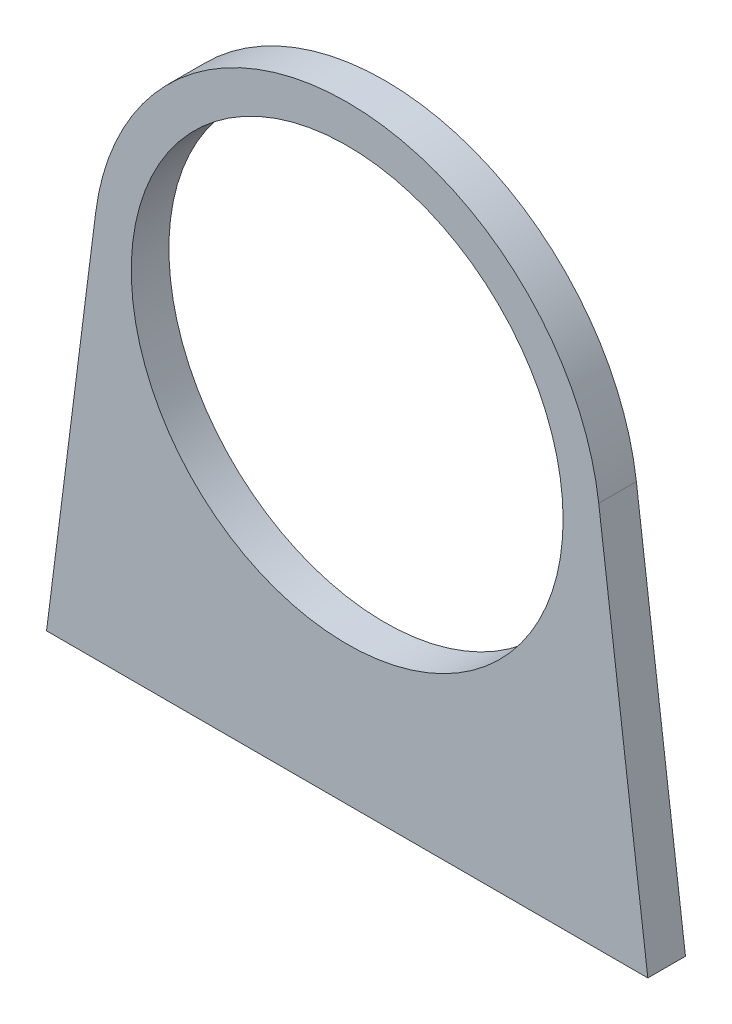
from build123d import *

# Parameters (mm, degrees)
SKETCH1_R           = 14.571169074
BOSS_EXTRUDE1_DEPTH = 2.54


with BuildPart() as part:
    # Sketch1 → Boss-Extrude1 (new body)
    with BuildSketch(Plane.XY):
        with BuildLine():
            Line((-16.974842815, 2.155648038), (-20.287593364, -23.930901742))
            Line((-20.287593364, -23.930901742), (20.287593364, -23.930901742))
            Line((20.287593364, -23.930901742), (16.974842815, 2.155648038))
            ThreePointArc((16.974842815, 2.155648038), (0, 17.111169074), (-16.974842815, 2.155648038))
        make_face()
        Circle(SKETCH1_R, mode=Mode.SUBTRACT)
    extrude(amount=BOSS_EXTRUDE1_DEPTH)


solid = part.part
